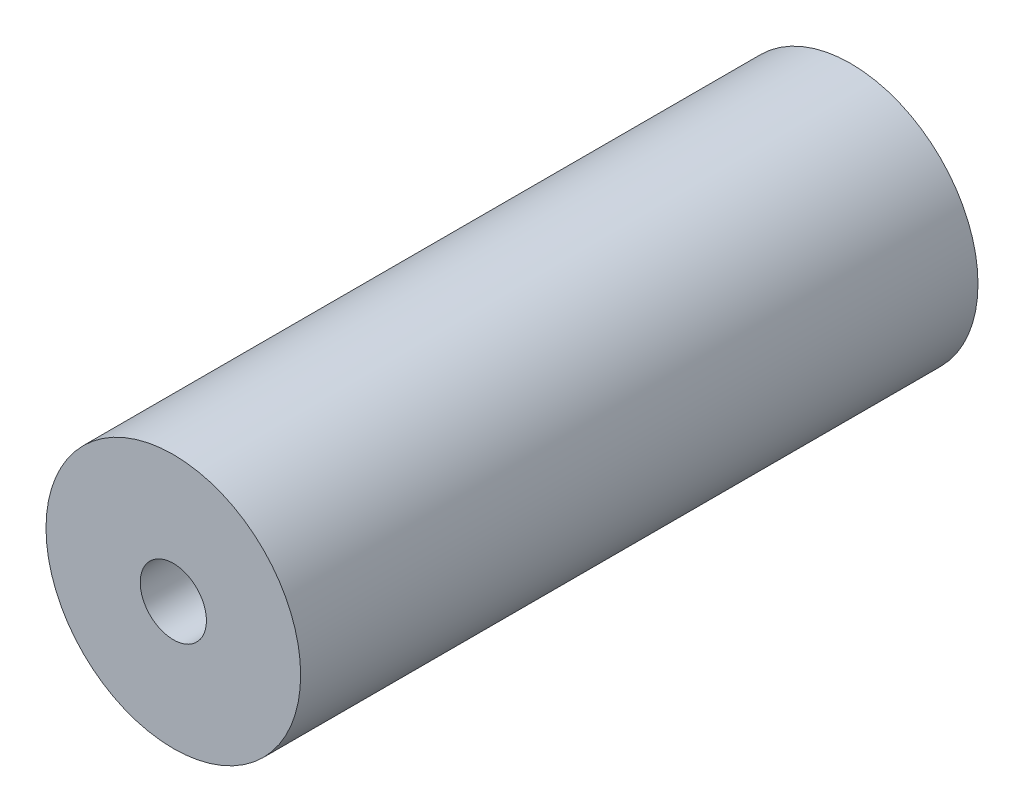
from build123d import *

# Parameters (mm, degrees)
SKETCH_1_R      = 5
SKETCH_1_R_2    = 1.3
EXTRUDE_1_DEPTH = 26.6


with BuildPart() as part:
    # ｽｹｯﾁ1 → ﾎﾞｽ - 押し出し1 (new body)
    with BuildSketch(Plane.XY):
        Circle(SKETCH_1_R)
        Circle(SKETCH_1_R_2, mode=Mode.SUBTRACT)
    extrude(amount=EXTRUDE_1_DEPTH)


solid = part.part
